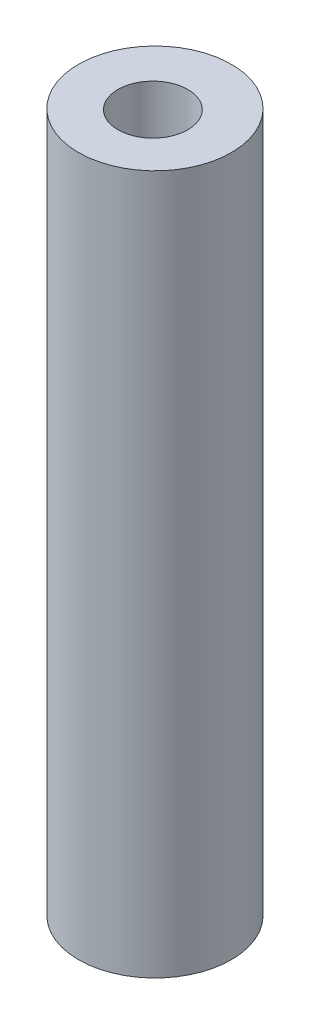
from build123d import *

# Parameters (mm, degrees)
SKETCH1_R           = 3.5
SKETCH1_R_2         = 1.6
BOSS_EXTRUDE1_DEPTH = 32


with BuildPart() as part:
    # Sketch1 → Boss-Extrude1 (new body)
    with BuildSketch(Plane(origin=(0, 0, 0), x_dir=(1, 0, 0), z_dir=(0, 1, 0))):
        Circle(SKETCH1_R)
        with Locations((0, -0.095073122)):
            Circle(SKETCH1_R_2, mode=Mode.SUBTRACT)
    extrude(amount=BOSS_EXTRUDE1_DEPTH)


solid = part.part
